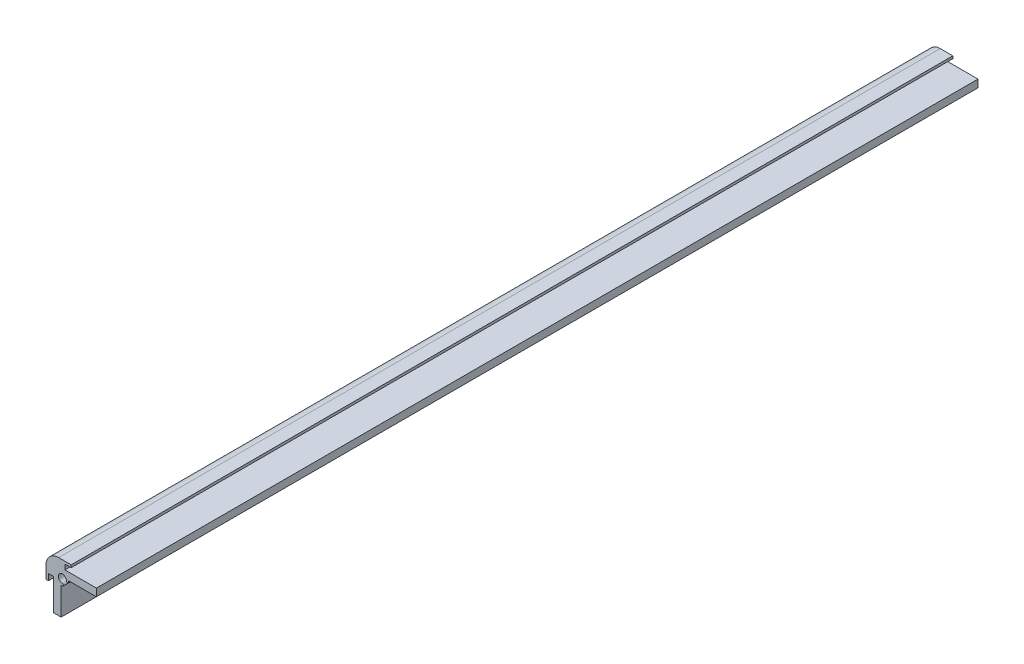
from build123d import *

# Parameters (mm, degrees)
EXTRUDE_1_DEPTH = 350


with BuildPart() as part:
    # Model → 凸台-拉伸1 (new body)
    with BuildSketch(Plane.XY):
        with BuildLine():
            Line((1340.138554246, 805.862554257), (1345.138554246, 805.862554257))
            Line((1345.138554246, 805.862554257), (1345.138554246, 804.862554257))
            Line((1345.138554246, 804.862554257), (1342.638554246, 804.862554257))
            Line((1342.638554246, 804.862554257), (1342.638554246, 802.862554257))
            Line((1342.638554246, 802.862554257), (1355.138554246, 802.862554257))
            Line((1355.138554246, 802.862554257), (1355.138554246, 799.862554257))
            Line((1355.138554246, 799.862554257), (1344.038554246, 799.862554257))
            Line((1344.038554246, 799.862554257), (1344.038554246, 799.362554257))
            ThreePointArc((1344.038554246, 799.362554257), (1343.638554246, 798.962554257), (1343.238554246, 799.362554257))
            ThreePointArc((1343.238554246, 799.362554257), (1340.507183396, 800.493925107), (1341.638554246, 797.762554257))
            ThreePointArc((1341.638554246, 797.762554257), (1342.09519806, 797.220410998), (1341.483330886, 796.862554257))
            Line((1341.483330886, 796.862554257), (1341.138554246, 796.862554257))
            Line((1341.138554246, 796.862554257), (1341.138554246, 785.862554257))
            Line((1341.138554246, 785.862554257), (1338.138554246, 785.862554257))
            Line((1338.138554246, 785.862554257), (1338.138554246, 798.362554257))
            Line((1338.138554246, 798.362554257), (1336.138554246, 798.362554257))
            Line((1336.138554246, 798.362554257), (1336.138554246, 795.862554257))
            Line((1336.138554246, 795.862554257), (1335.138554246, 795.862554257))
            Line((1335.138554246, 795.862554257), (1335.138554246, 800.862554257))
            ThreePointArc((1335.138554246, 800.862554257), (1336.60302034, 804.398088163), (1340.138554246, 805.862554257))
        make_face()
    extrude(amount=EXTRUDE_1_DEPTH)


solid = part.part
